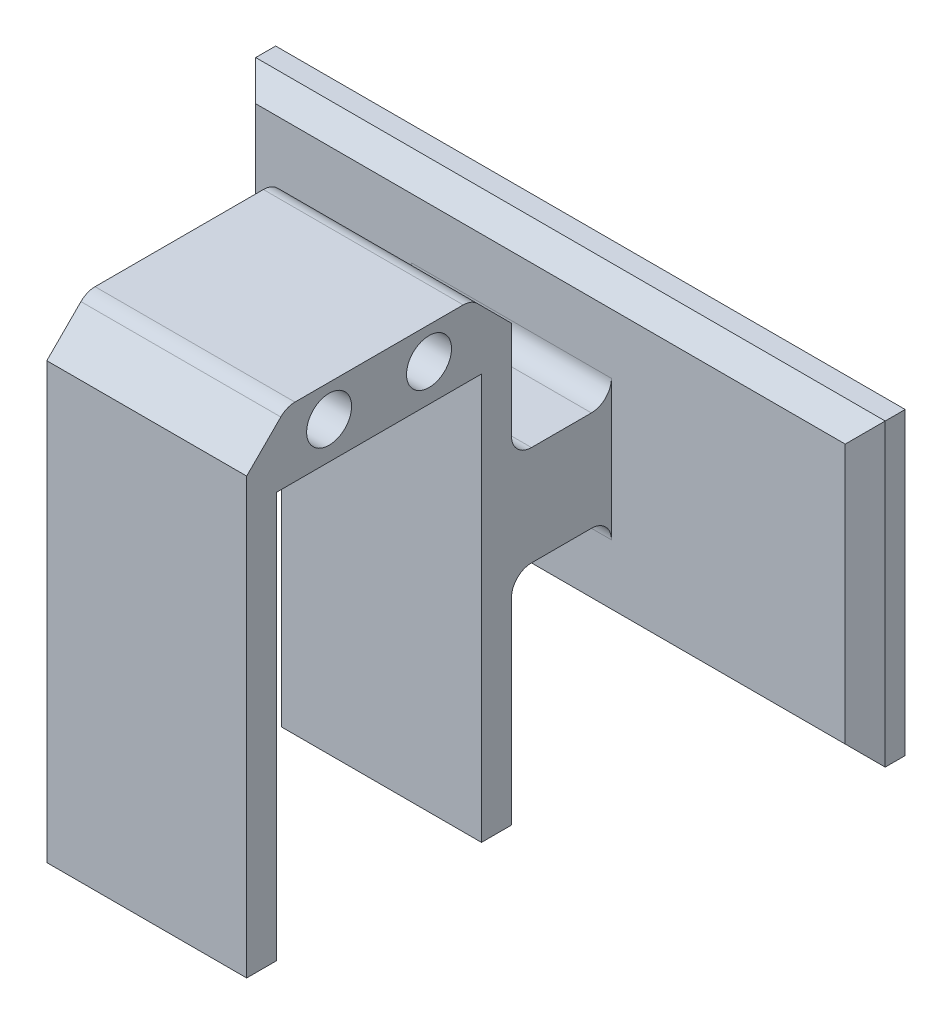
from build123d import *

# Parameters (mm, degrees)
SKETCH1_R           = 2.25
BOSS_EXTRUDE1_DEPTH = 20
SKETCH2_R           = 2.25
BOSS_EXTRUDE2_DEPTH = 10
SKETCH4_W           = 26.5
SKETCH4_H           = 2.5
CUT_EXTRUDE1_DEPTH  = 39.17921555
CHAMFER2_SIZE       = 4
CHAMFER3_SIZE       = 4
FILLET4_R           = 2
SKETCH7_W           = 10
SKETCH7_H           = 10
BOSS_EXTRUDE5_DEPTH = 20
FILLET6_R           = 2
SKETCH8_W           = 63
SKETCH8_H           = 30
BOSS_EXTRUDE6_DEPTH = 4
CHAMFER4_SIZE       = 2
FILLET7_R           = 2


with BuildPart() as part:
    # Sketch1 → Boss-Extrude1 (new body)
    with BuildSketch(Plane(origin=(0, 0, 0), x_dir=(0, 0, -1), z_dir=(1, 0, 0))):
        Polygon((10.25, -20.3), (13.25, -20.3), (13.25, 29.7), (-13.25, 29.7), (-13.25, -20.3), (-10.25, -20.3), (-10.25, 20.3), (10.25, 20.3), align=None)
        with Locations((5, 24)):
            Circle(SKETCH1_R, mode=Mode.SUBTRACT)
        with Locations((-5, 24)):
            Circle(SKETCH1_R, mode=Mode.SUBTRACT)
    extrude(amount=BOSS_EXTRUDE1_DEPTH)

    # Sketch2 → Boss-Extrude2 (add)
    with BuildSketch(Plane.ZY):
        with Locations((-5, 24)):
            Circle(SKETCH2_R)
        with Locations((5, 24)):
            Circle(SKETCH2_R)
    extrude(amount=-BOSS_EXTRUDE2_DEPTH)

    # Sketch4 → Cut-Extrude1 (cut, through all)
    with BuildSketch(Plane(origin=(20, 0, 0), x_dir=(0, 0, -1), z_dir=(1, 0, 0))):
        with Locations((0, 28.45)):
            Rectangle(SKETCH4_W, SKETCH4_H)
    extrude(amount=-CUT_EXTRUDE1_DEPTH, mode=Mode.SUBTRACT)

    # Chamfer2
    chamfer2_edges = [part.edges().sort_by_distance(p)[0] for p in [
        (10, 27.2, -13.25),
    ]]
    chamfer(chamfer2_edges, length=CHAMFER2_SIZE)

    # Chamfer3
    chamfer3_edges = [part.edges().sort_by_distance(p)[0] for p in [
        (10, 27.2, 13.25),
    ]]
    chamfer(chamfer3_edges, length=CHAMFER3_SIZE)

    # Fillet4
    fillet4_edges = [part.edges().sort_by_distance(p)[0] for p in [
        (10, 27.2, -9.25),
        (10, 27.2, 9.25),
    ]]
    fillet(fillet4_edges, radius=FILLET4_R)

    # Sketch7 → Boss-Extrude5 (add)
    with BuildSketch(Plane(origin=(20, 0, 0), x_dir=(0, 0, -1), z_dir=(1, 0, 0))):
        with Locations((18.25, 6.423218073)):
            Rectangle(SKETCH7_W, SKETCH7_H)
    extrude(amount=-BOSS_EXTRUDE5_DEPTH)

    # Fillet6
    fillet6_edges = [part.edges().sort_by_distance(p)[0] for p in [
        (10, 1.423218073, -13.25),
        (10, 11.423218073, -13.25),
    ]]
    fillet(fillet6_edges, radius=FILLET6_R)

    # Sketch8 → Boss-Extrude6 (add)
    with BuildSketch(Plane(origin=(0, 0, -23.25), x_dir=(-1, 0, 0), z_dir=(0, 0, -1))):
        with Locations((-13.9, 6.423218073)):
            Rectangle(SKETCH8_W, SKETCH8_H)
    extrude(amount=BOSS_EXTRUDE6_DEPTH)

    # Chamfer4
    chamfer4_edges = [part.edges().sort_by_distance(p)[0] for p in [
        (45.4, 6.423218073, -23.25),
        (13.9, -8.576781927, -23.25),
        (-17.6, 6.423218073, -23.25),
        (13.9, 21.423218073, -23.25),
    ]]
    chamfer(chamfer4_edges, length=CHAMFER4_SIZE)

    # Fillet7
    fillet7_edges = [part.edges().sort_by_distance(p)[0] for p in [
        (10, 11.423218073, -23.25),
        (10, 1.423218073, -23.25),
    ]]
    fillet(fillet7_edges, radius=FILLET7_R)


solid = part.part
